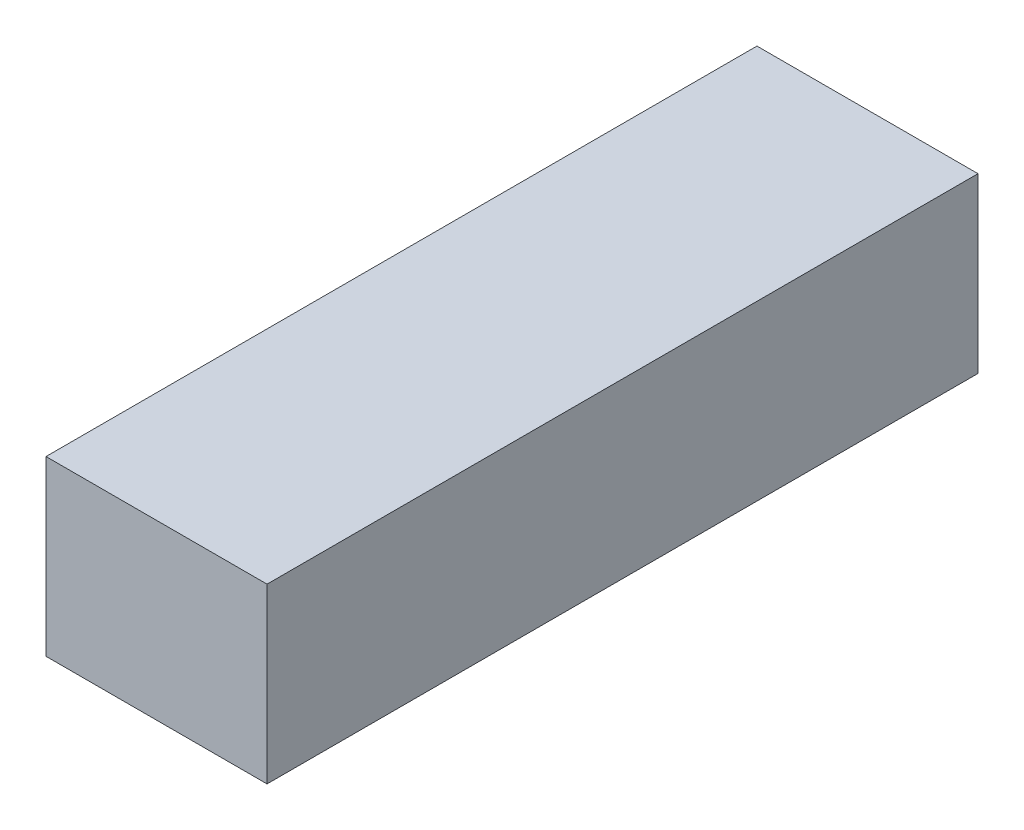
from build123d import *

# Parameters (mm, degrees)
SKETCH1_W           = 43.434
SKETCH1_H           = 139.7
BOSS_EXTRUDE1_DEPTH = 34


with BuildPart() as part:
    # Sketch1 → Boss-Extrude1 (new body)
    with BuildSketch(Plane(origin=(0, 0, 0), x_dir=(1, 0, 0), z_dir=(0, 1, 0))):
        with Locations((0, 69.85)):
            Rectangle(SKETCH1_W, SKETCH1_H)
    extrude(amount=BOSS_EXTRUDE1_DEPTH)


solid = part.part
